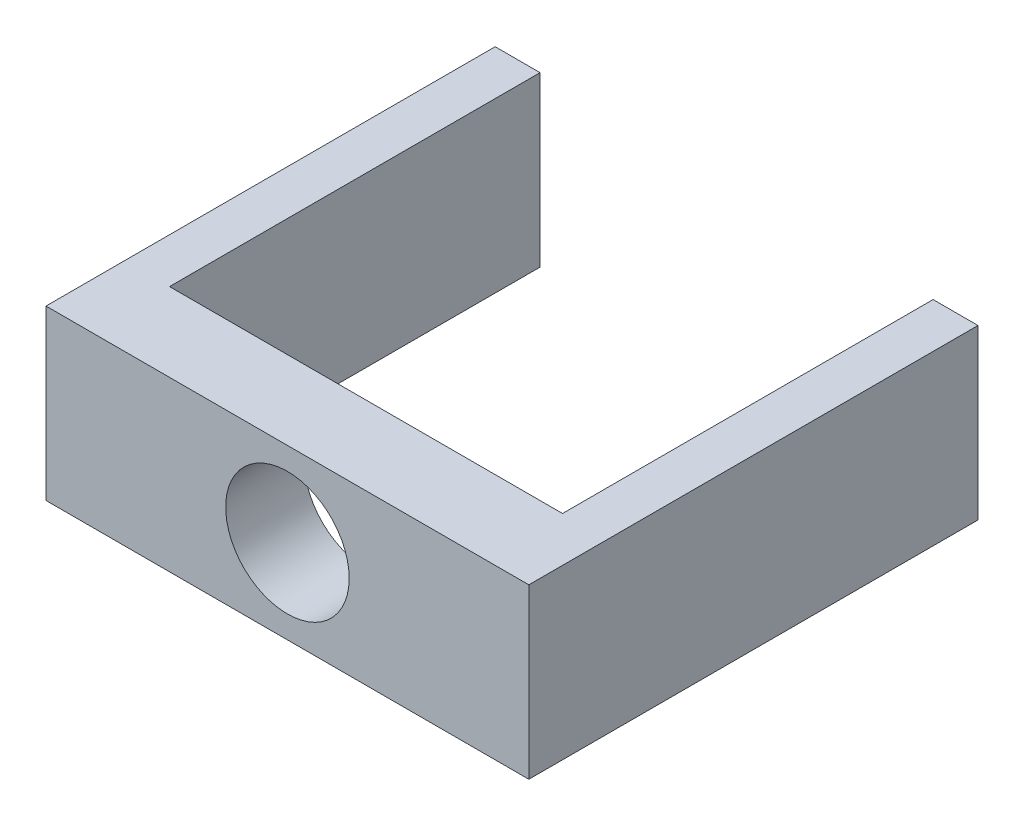
from build123d import *

# Parameters (mm, degrees)
SKETCH1_W           = 35
SKETCH1_H           = 15
SKETCH1_R           = 5.5
BOSS_EXTRUDE1_DEPTH = 7
SKETCH2_W           = 4
SKETCH2_H           = 15
BOSS_EXTRUDE2_DEPTH = 40


with BuildPart() as part:
    # Sketch1 → Boss-Extrude1 (new body)
    with BuildSketch(Plane.XY):
        Rectangle(SKETCH1_W, SKETCH1_H)
        Circle(SKETCH1_R, mode=Mode.SUBTRACT)
    extrude(amount=BOSS_EXTRUDE1_DEPTH)

    # Sketch2 → Boss-Extrude2 (add)
    with BuildSketch(Plane.XY.offset(7)):
        with Locations((19.5, 0)):
            Rectangle(SKETCH2_W, SKETCH2_H)
        with Locations((-19.5, 0)):
            Rectangle(SKETCH2_W, SKETCH2_H)
    extrude(amount=-BOSS_EXTRUDE2_DEPTH)


solid = part.part
